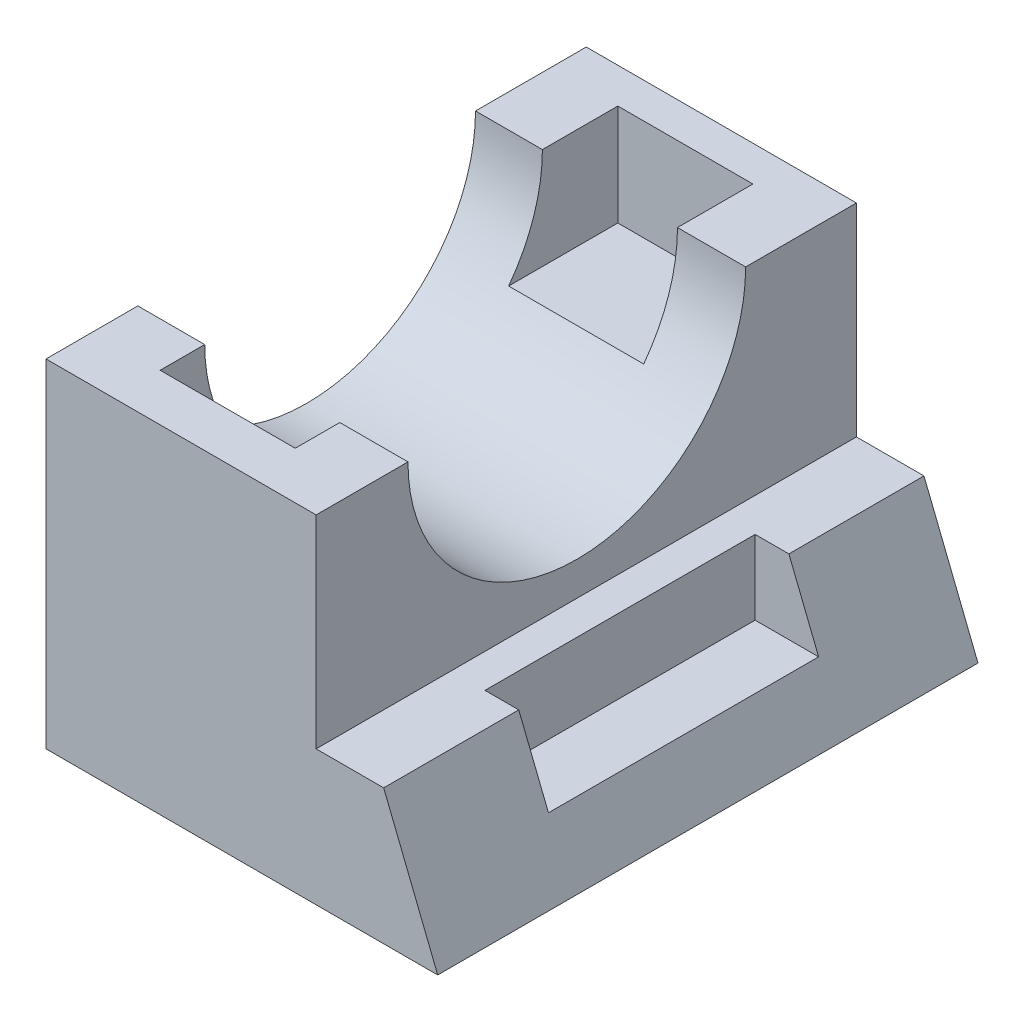
from build123d import *

# Parameters (mm, degrees)
BOSS_EXTRUDE1_DEPTH = 80
CUT_EXTRUDE1_DEPTH  = 80
SKETCH3_W           = 20
SKETCH3_H           = 67.765549713
CUT_EXTRUDE2_DEPTH  = 15
SKETCH6_W           = 10
SKETCH6_H           = 40
CUT_EXTRUDE4_DEPTH  = 11


with BuildPart() as part:
    # Sketch1 → Boss-Extrude1 (new body)
    with BuildSketch(Plane.XY):
        Polygon((0, 50), (0, 0), (58, 0), (50, 20), (40, 20), (40, 50), align=None)
    extrude(amount=BOSS_EXTRUDE1_DEPTH)

    # Sketch2 → Cut-Extrude1 (cut)
    with BuildSketch(Plane.ZY):
        with BuildLine():
            Line((66.402636912, 50), (16.402636912, 50))
            ThreePointArc((16.402636912, 50), (41.402636912, 25), (66.402636912, 50))
        make_face()
    extrude(amount=-CUT_EXTRUDE1_DEPTH, mode=Mode.SUBTRACT)

    # Sketch3 → Cut-Extrude2 (cut)
    with BuildSketch(Plane(origin=(0, 50, 0), x_dir=(1, 0, 0), z_dir=(0, 1, 0))):
        with Locations((19.905264977, -39.117225144)):
            Rectangle(SKETCH3_W, SKETCH3_H)
    extrude(amount=-CUT_EXTRUDE2_DEPTH, mode=Mode.SUBTRACT)

    # Sketch6 → Cut-Extrude4 (cut)
    with BuildSketch(Plane(origin=(0, 20, 0), x_dir=(1, 0, 0), z_dir=(0, 1, 0))):
        with Locations((50, -40)):
            Rectangle(SKETCH6_W, SKETCH6_H)
    extrude(amount=-CUT_EXTRUDE4_DEPTH, mode=Mode.SUBTRACT)


solid = part.part
